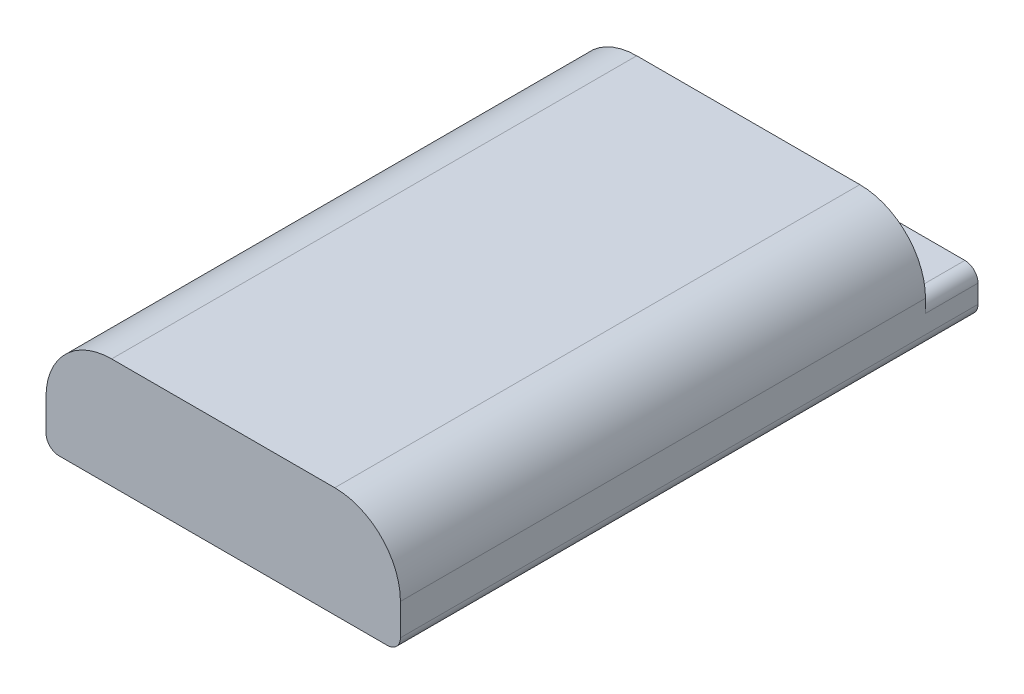
from build123d import *

# Parameters (mm, degrees)
SKETCH1_W           = 34.29
SKETCH1_H           = 55.88
BOSS_EXTRUDE1_DEPTH = 4.318
SKETCH2_W           = 34.29
SKETCH2_H           = 50.8
BOSS_EXTRUDE2_DEPTH = 6.35
SKETCH3_OUTSIDE_W   = 49.574
SKETCH3_OUTSIDE_H   = 25.952
CUT_EXTRUDE1_DEPTH  = 5.08
CUT_EXTRUDE2_DEPTH  = 55.666234999
SKETCH6_R           = 0.635
CUT_EXTRUDE3_DEPTH  = 0.127


with BuildPart() as part:
    # Sketch1 → Boss-Extrude1 (new body)
    with BuildSketch(Plane(origin=(0, 0, 0), x_dir=(1, 0, 0), z_dir=(0, 1, 0))):
        Rectangle(SKETCH1_W, SKETCH1_H)
    extrude(amount=BOSS_EXTRUDE1_DEPTH)

    # Sketch2 → Boss-Extrude2 (add)
    with BuildSketch(Plane(origin=(0, 4.318, 0), x_dir=(1, 0, 0), z_dir=(0, 1, 0))):
        with Locations((0, -2.54)):
            Rectangle(SKETCH2_W, SKETCH2_H)
    extrude(amount=BOSS_EXTRUDE2_DEPTH)

    # Sketch3 outside → Cut-Extrude1 (cut)
    with BuildSketch(Plane(origin=(0, 0, -27.94), x_dir=(-1, 0, 0), z_dir=(0, 0, -1))):
        with Locations((0, 5.334)):
            Rectangle(SKETCH3_OUTSIDE_W, SKETCH3_OUTSIDE_H)
        with BuildLine():
            Line((-15.875, 0), (15.875, 0))
            ThreePointArc((15.875, 0), (16.773025612, 0.371974388), (17.145, 1.27))
            Line((17.145, 1.27), (17.145, 3.048))
            ThreePointArc((17.145, 3.048), (16.773025612, 3.946025612), (15.875, 4.318))
            Line((15.875, 4.318), (-15.875, 4.318))
            ThreePointArc((-15.875, 4.318), (-16.773025612, 3.946025612), (-17.145, 3.048))
            Line((-17.145, 3.048), (-17.145, 1.27))
            ThreePointArc((-17.145, 1.27), (-16.773025612, 0.371974388), (-15.875, 0))
        make_face(mode=Mode.SUBTRACT)
    extrude(amount=-CUT_EXTRUDE1_DEPTH, mode=Mode.SUBTRACT)

    # Sketch4 → Cut-Extrude2 (cut, through all)
    with BuildSketch(Plane(origin=(0, 0, -22.86), x_dir=(-1, 0, 0), z_dir=(0, 0, -1))):
        with BuildLine():
            Line((-17.145, 10.668), (-17.145, 4.318))
            ThreePointArc((-17.145, 4.318), (-15.285128061, 8.808128061), (-10.795, 10.668))
            Line((-10.795, 10.668), (-17.145, 10.668))
        make_face()
        with BuildLine():
            Line((17.145, 10.668), (10.795, 10.668))
            ThreePointArc((10.795, 10.668), (15.285128061, 8.808128061), (17.145, 4.318))
            Line((17.145, 4.318), (17.145, 10.668))
        make_face()
        with BuildLine():
            Line((-17.145, 1.27), (-17.145, 0))
            Line((-17.145, 0), (-15.875, 0))
            ThreePointArc((-15.875, 0), (-16.773025612, 0.371974388), (-17.145, 1.27))
        make_face()
        with BuildLine():
            Line((17.145, 0), (17.145, 1.27))
            ThreePointArc((17.145, 1.27), (16.773025612, 0.371974388), (15.875, 0))
            Line((15.875, 0), (17.145, 0))
        make_face()
    extrude(amount=-CUT_EXTRUDE2_DEPTH, mode=Mode.SUBTRACT)

    # Sketch6 → Cut-Extrude3 (cut)
    with BuildSketch(Plane(origin=(0, 4.318, 0), x_dir=(1, 0, 0), z_dir=(0, 1, 0))):
        with Locations(Location((-2.54, 25.4, 0), (0, 0, 270))):
            Circle(SKETCH6_R)
        with Locations(Location((2.54, 25.4, 0), (0, 0, 90))):
            Circle(SKETCH6_R)
    extrude(amount=-CUT_EXTRUDE3_DEPTH, mode=Mode.SUBTRACT)


solid = part.part
